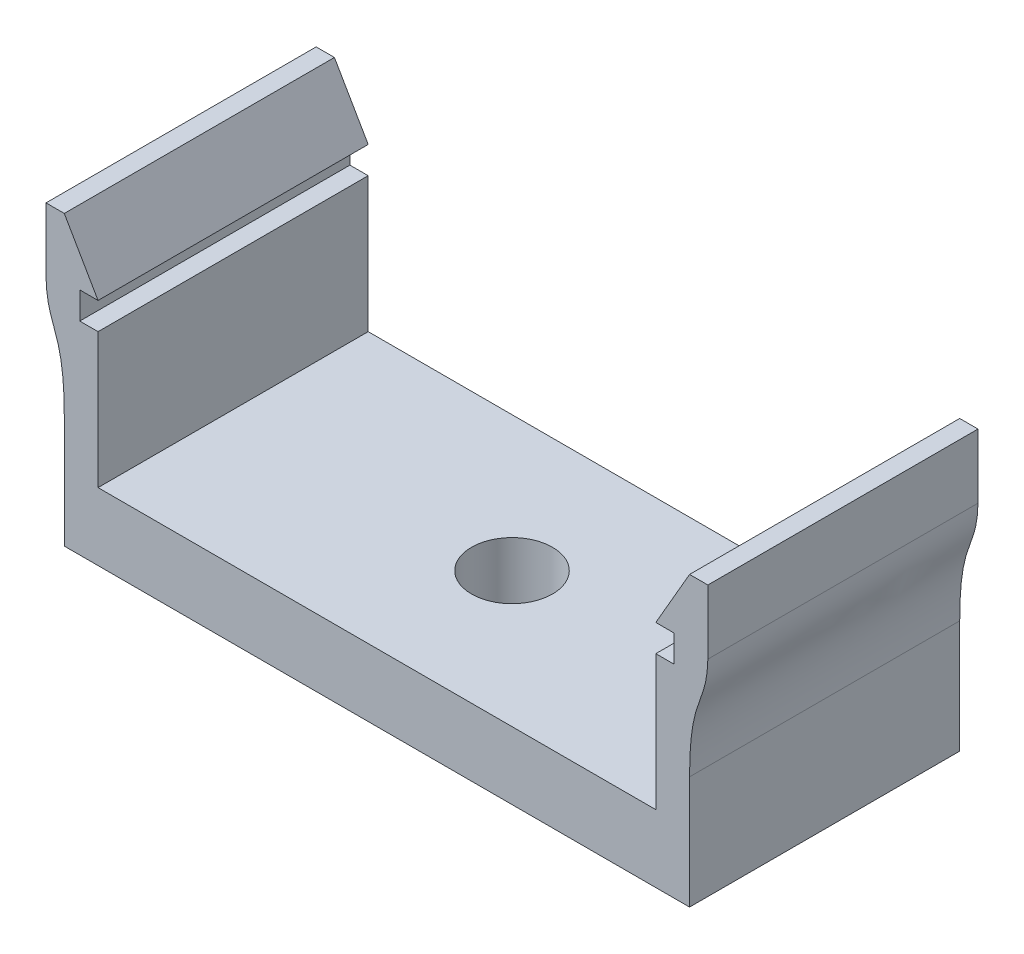
from build123d import *

# Parameters (mm, degrees)
BOSS_EXTRUDE1_DEPTH = 12.7
SKETCH2_R           = 1.905
CUT_EXTRUDE1_DEPTH  = 12.7


with BuildPart() as part:
    # Sketch1 → Boss-Extrude1 (new body)
    with BuildSketch(Plane.XY):
        with BuildLine():
            Line((0, 0), (0, 3.175))
            Line((0, 3.175), (-13.110280444, 3.175))
            Line((-13.110280444, 3.175), (-13.110280444, 9.525))
            Line((-13.110280444, 9.525), (-13.97, 9.525))
            Line((-13.97, 9.525), (-13.97, 10.795))
            Line((-13.97, 10.795), (-13.110280444, 10.795))
            Line((-13.110280444, 10.795), (-14.697780444, 13.544630657))
            Line((-14.697780444, 13.544630657), (-15.5575, 13.544630657))
            Line((-15.5575, 13.544630657), (-15.5575, 10.524942302))
            add(Edge.make_bspline(
                [(-14.697780444, 5.304098901), (-14.697780444, 8.859756712), (-15.501871983, 8.436070985), (-15.5575, 10.524942302)],
                knots=[0, 0, 0, 0, 1, 1, 1, 1], degree=3))
            Line((-14.697780444, 5.304098901), (-14.697780444, 0))
            Line((-14.697780444, 0), (0, 0))
        make_face()
    boss_extrude1 = extrude(amount=BOSS_EXTRUDE1_DEPTH)

    # Mirror1: Boss-Extrude1 across plane
    add(boss_extrude1.mirror(Plane(origin=(0, 0, 0), x_dir=(0, 0, 1), z_dir=(1, 0, 0))))

    # Sketch2 → Cut-Extrude1 (cut)
    with BuildSketch(Plane(origin=(0, 3.175, 0), x_dir=(1, 0, 0), z_dir=(0, 1, 0))):
        with Locations(Location((0, -6.35, 0), (0, 0, 270))):
            Circle(SKETCH2_R)
    extrude(amount=-CUT_EXTRUDE1_DEPTH, mode=Mode.SUBTRACT)


solid = part.part
